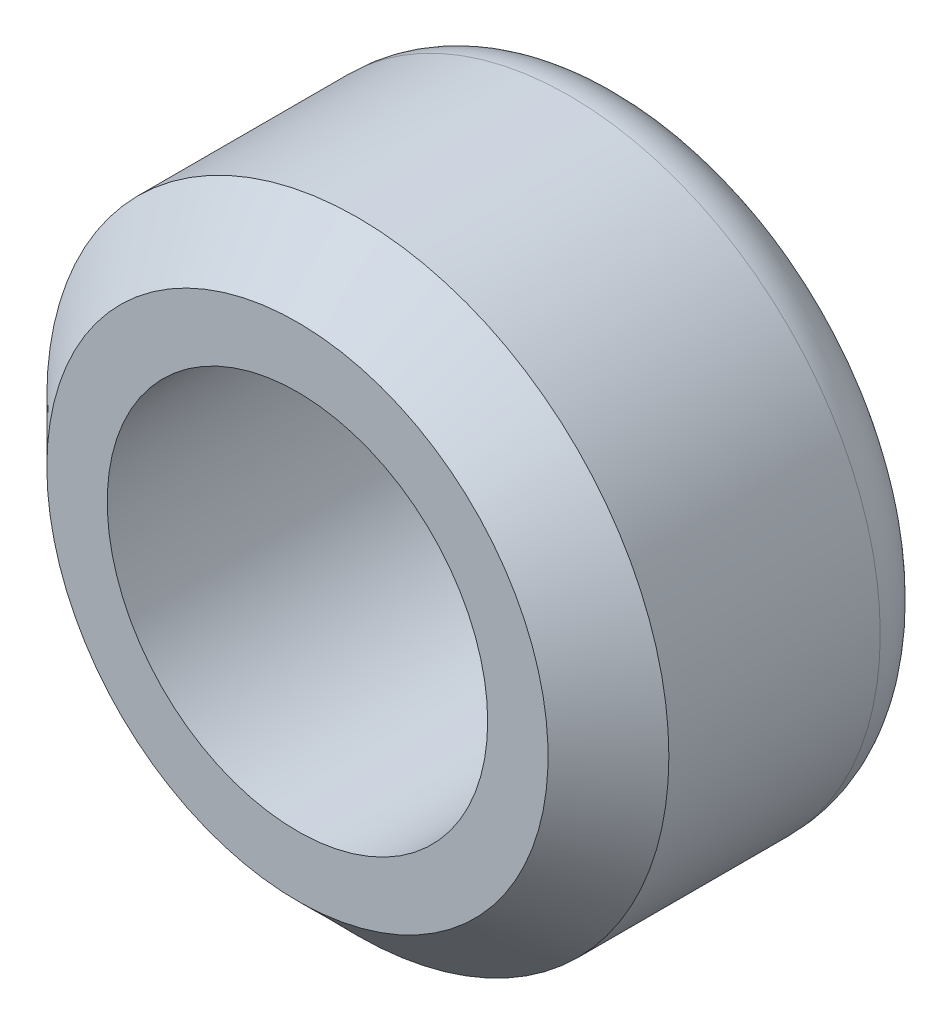
from build123d import *

# Parameters (mm, degrees)
SKETCH1_W     = 2
SKETCH1_H     = 5.5
CHAMFER1_SIZE = 1
FILLET1_R     = 1


with BuildPart() as part:
    # Sketch1 → Revolve1 (revolve)
    with BuildSketch(Plane(origin=(0, 0, 0), x_dir=(1, 0, 0), z_dir=(0, 1, 0)), mode=Mode.PRIVATE) as revolve1_sk:
        with Locations((-4.15, 2.75)):
            Rectangle(SKETCH1_W, SKETCH1_H)
    revolve(revolve1_sk.sketch.rotate(Axis((0, 0, 0), (0, 0, -1)), 180), axis=Axis((0, 0, 0), (0, 0, -1)))

    # Chamfer1
    chamfer1_edges = [part.edges().sort_by_distance(p)[0] for p in [
        (-5.15, 0, 0),
    ]]
    chamfer(chamfer1_edges, length=CHAMFER1_SIZE)

    # Fillet1
    fillet1_edges = [part.edges().sort_by_distance(p)[0] for p in [
        (-5.15, 0, -5.5),
    ]]
    fillet(fillet1_edges, radius=FILLET1_R)


solid = part.part
